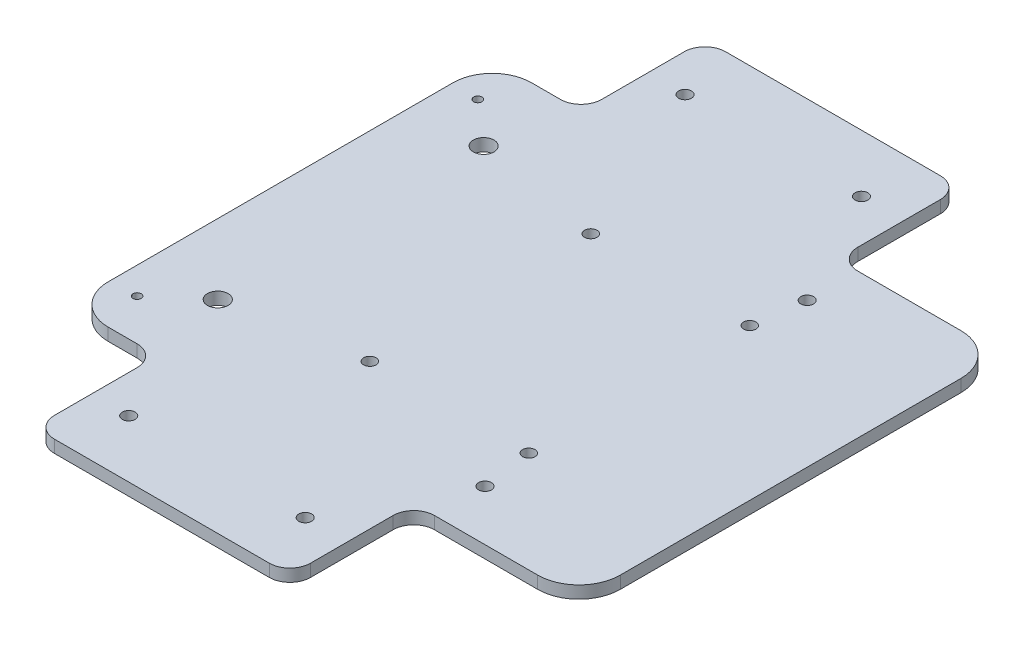
from build123d import *

# Parameters (mm, degrees)
SKETCH_1_R      = 1.5
SKETCH_1_R_2    = 2.5
SKETCH_1_R_3    = 1.55
SKETCH_1_R_4    = 1
EXTRUDE_1_DEPTH = 3


with BuildPart() as part:
    # 草图1 → 凸台-拉伸1 (new body)
    with BuildSketch(Plane(origin=(0, 0, 0), x_dir=(1, 0, 0), z_dir=(0, 1, 0))):
        with BuildLine():
            Line((132, -5), (132, -25))
            ThreePointArc((132, -25), (130.535533906, -28.535533906), (127, -30))
            Line((127, -30), (75, -30))
            ThreePointArc((75, -30), (71.464466094, -28.535533906), (70, -25))
            Line((70, -25), (70, -5))
            ThreePointArc((70, -5), (68.535533906, -1.464466094), (65, 0))
            Line((65, 0), (58, 0))
            ThreePointArc((58, 0), (51.282485579, 2.782485579), (48.5, 9.5))
            Line((48.5, 9.5), (48.5, 93))
            ThreePointArc((48.5, 93), (51.282485579, 99.717514421), (58, 102.5))
            Line((58, 102.5), (65, 102.5))
            ThreePointArc((65, 102.5), (68.535533906, 103.964466094), (70, 107.5))
            Line((70, 107.5), (70, 127.5))
            ThreePointArc((70, 127.5), (71.464466094, 131.035533906), (75, 132.5))
            Line((75, 132.5), (127, 132.5))
            ThreePointArc((127, 132.5), (130.535533906, 131.035533906), (132, 127.5))
            Line((132, 127.5), (132, 107.5))
            ThreePointArc((132, 107.5), (133.464466094, 103.964466094), (137, 102.5))
            Line((137, 102.5), (162, 102.5))
            ThreePointArc((162, 102.5), (169.071067812, 99.571067812), (172, 92.5))
            Line((172, 92.5), (172, 10))
            ThreePointArc((172, 10), (169.071067812, 2.928932188), (162, 0))
            Line((162, 0), (137, 0))
            ThreePointArc((137, 0), (133.464466094, -1.464466094), (132, -5))
        make_face()
        with Locations(Location((96.855482095, 24.5, 0), (0, 0, 270))):
            Circle(SKETCH_1_R, mode=Mode.SUBTRACT)
        with Locations(Location((135.355482095, 24.5, 0), (0, 0, 270))):
            Circle(SKETCH_1_R, mode=Mode.SUBTRACT)
        with Locations(Location((65.477875917, 19.059382071, 0), (0, 0, 270))):
            Circle(SKETCH_1_R_2, mode=Mode.SUBTRACT)
        with Locations(Location((79.074216313, -16.098364995, 0), (0, 0, 270))):
            Circle(SKETCH_1_R_3, mode=Mode.SUBTRACT)
        with Locations(Location((121.803446989, -16.098364995, 0), (0, 0, 270))):
            Circle(SKETCH_1_R_3, mode=Mode.SUBTRACT)
        with Locations(Location((135.355482095, 78, 0), (0, 0, 90))):
            Circle(SKETCH_1_R, mode=Mode.SUBTRACT)
        with Locations(Location((96.855482095, 78, 0), (0, 0, 90))):
            Circle(SKETCH_1_R, mode=Mode.SUBTRACT)
        with Locations(Location((65.477875917, 83.440617929, 0), (0, 0, 90))):
            Circle(SKETCH_1_R_2, mode=Mode.SUBTRACT)
        with Locations(Location((55, 10, 0), (0, 0, 270))):
            Circle(SKETCH_1_R_4, mode=Mode.SUBTRACT)
        with Locations(Location((55, 92.5, 0), (0, 0, 90))):
            Circle(SKETCH_1_R_4, mode=Mode.SUBTRACT)
        with Locations(Location((121.803446989, 118.598364995, 0), (0, 0, 90))):
            Circle(SKETCH_1_R_3, mode=Mode.SUBTRACT)
        with Locations(Location((79.074216313, 118.598364995, 0), (0, 0, 90))):
            Circle(SKETCH_1_R_3, mode=Mode.SUBTRACT)
        with Locations(Location((137, 90.25, 0), (0, 0, 270))):
            Circle(SKETCH_1_R_3, mode=Mode.SUBTRACT)
        with Locations(Location((137, 12.25, 0), (0, 0, 90))):
            Circle(SKETCH_1_R_3, mode=Mode.SUBTRACT)
    extrude(amount=EXTRUDE_1_DEPTH)


solid = part.part
